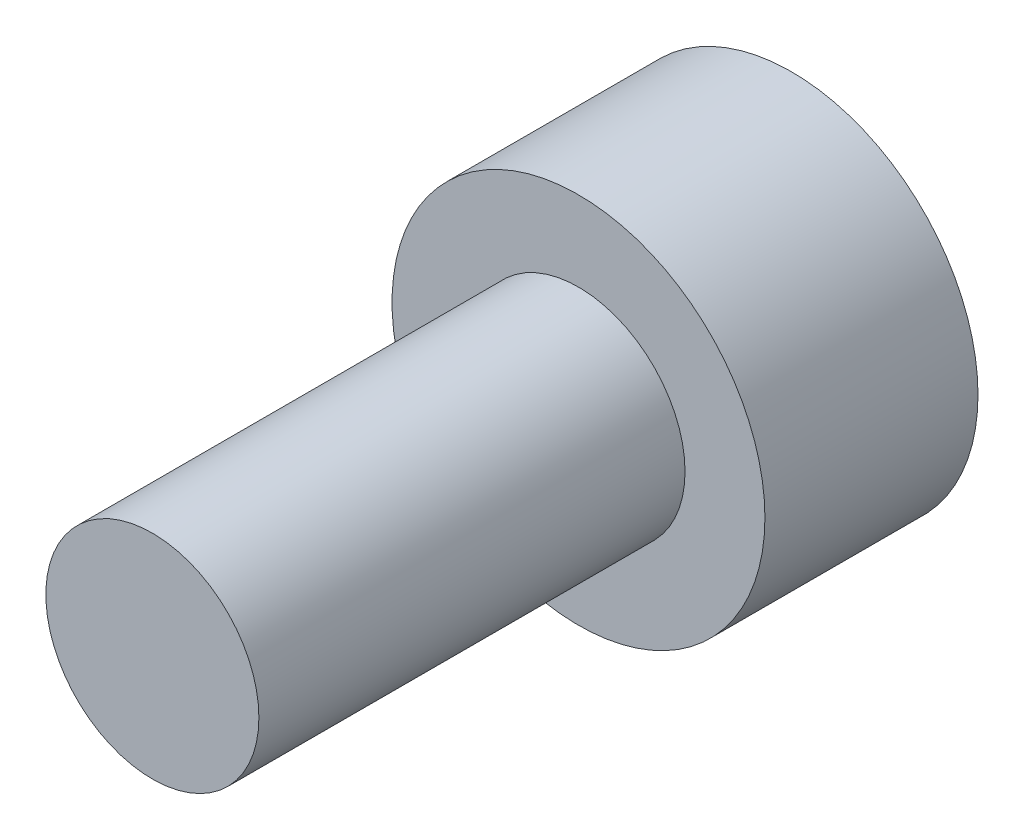
from build123d import *

# Parameters (mm, degrees)
SKETCH1_R           = 2
BOSS_EXTRUDE1_DEPTH = 8
SKETCH2_R           = 3.5
BOSS_EXTRUDE2_DEPTH = 4


with BuildPart() as part:
    # Sketch1 → Boss-Extrude1 (new body)
    with BuildSketch(Plane.XY):
        Circle(SKETCH1_R)
    extrude(amount=BOSS_EXTRUDE1_DEPTH)

    # Sketch2 → Boss-Extrude2 (add)
    with BuildSketch(Plane.XY):
        Circle(SKETCH2_R)
    extrude(amount=-BOSS_EXTRUDE2_DEPTH)


solid = part.part
